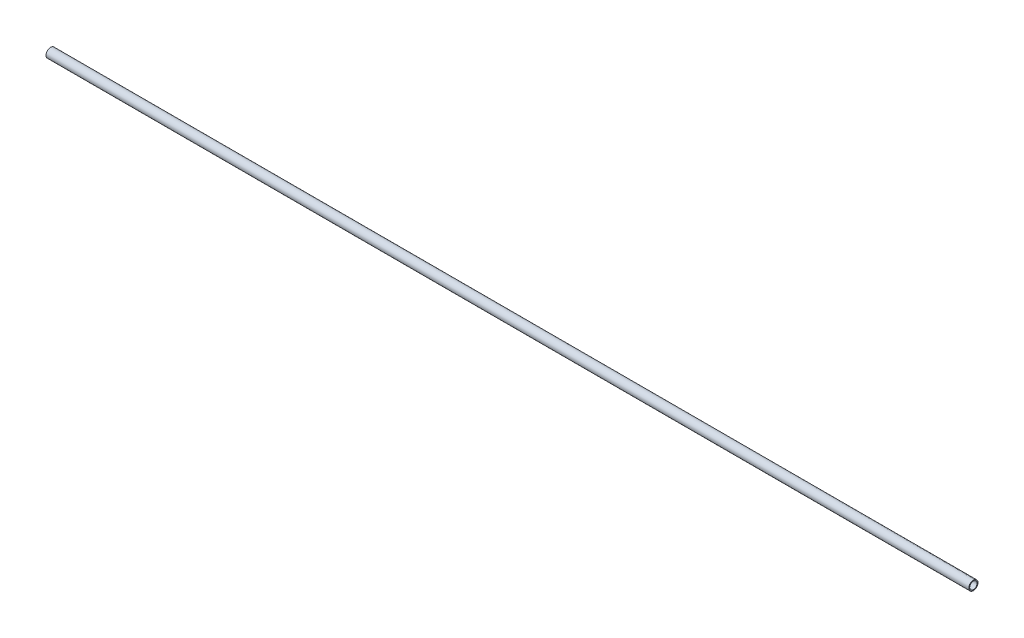
from build123d import *

# Parameters (mm, degrees)
SKETCH1_R           = 5
SKETCH1_R_2         = 4
BOSS_EXTRUDE1_DEPTH = 500


with BuildPart() as part:
    # Sketch1 → Boss-Extrude1 (new, symmetric)
    with BuildSketch(Plane(origin=(0, 0, 0), x_dir=(0, 0, -1), z_dir=(1, 0, 0))):
        Circle(SKETCH1_R)
        Circle(SKETCH1_R_2, mode=Mode.SUBTRACT)
    extrude(amount=BOSS_EXTRUDE1_DEPTH, both=True)


solid = part.part
